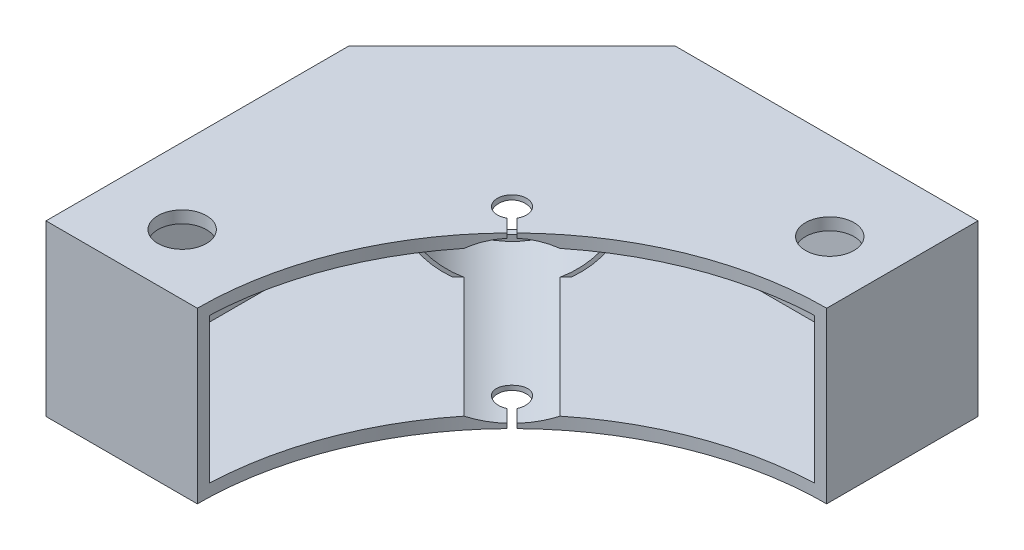
from build123d import *

# Parameters (mm, degrees)
BOSS_EXTRUDE1_DEPTH      = 28
SHELL1_T                 = -2
CUT_EXTRUDE1_DEPTH       = 12
CUT_EXTRUDE1_DEPTH_BACK  = 12
SKETCH9_R                = 6.4
SKETCH12_R               = 4
CUT_EXTRUDE3_DEPTH       = 2
BOSS_EXTRUDE2_DEPTH      = 0.0001
BOSS_EXTRUDE2_DEPTH_BACK = 10
SKETCH11_R               = 13.85
CUT_EXTRUDE4_DEPTH       = 35
CUT_EXTRUDE4_DEPTH_BACK  = 9
SKETCH13_R               = 13.25
CUT_EXTRUDE5_DEPTH       = 10
CUT_EXTRUDE5_DEPTH_BACK  = 10
SKETCH15_R               = 12.25


with BuildPart() as part:
    # Sketch1 → Boss-Extrude1 (new body)
    with BuildSketch(Plane(origin=(0, 0, 0), x_dir=(1, 0, 0), z_dir=(0, 1, 0))):
        with BuildLine():
            Line((0, 0), (0, 50))
            Line((0, 50), (27, 77))
            Line((27, 77), (77, 77))
            Line((77, 77), (77, 52))
            ThreePointArc((77, 52), (57.377961172, 48.155743087), (40.657159206, 37.191368932))
            Line((40.657159206, 37.191368932), (38.535838862, 39.312689275))
            ThreePointArc((38.535838862, 39.312689275), (34.771350846, 42.228649154), (37.687310725, 38.464161138))
            Line((37.687310725, 38.464161138), (39.808631068, 36.342840794))
            ThreePointArc((39.808631068, 36.342840794), (28.844256913, 19.622038828), (25, 0))
            Line((25, 0), (0, 0))
        make_face()
    extrude(amount=BOSS_EXTRUDE1_DEPTH)

    # Shell1
    shell1_openings = [part.faces().sort_by_distance(p)[0] for p in [
        (57.377961172, 14, -48.155743087),
        (28.844256913, 14, -19.622038828),
    ]]
    offset(amount=SHELL1_T, openings=shell1_openings, kind=Kind.INTERSECTION)

    # Sketch9 → Cut-Extrude1 (cut, two sides: drawn at the far end of the back side and taken through both)
    with BuildSketch(Plane(origin=(0, 14, 0), x_dir=(1, 0, 0), z_dir=(0, 1, 0)).offset(-CUT_EXTRUDE1_DEPTH_BACK)):
        with Locations((36.184678266, 38.815321734)):
            Circle(SKETCH9_R)
    extrude(amount=CUT_EXTRUDE1_DEPTH + CUT_EXTRUDE1_DEPTH_BACK, mode=Mode.SUBTRACT)

    # Sketch12 → Cut-Extrude3 (cut)
    with BuildSketch(Plane(origin=(0, 28, 0), x_dir=(1, 0, 0), z_dir=(0, 1, 0))):
        with Locations((67, 62.5)):
            Circle(SKETCH12_R)
        with Locations((12.5, 10)):
            Circle(SKETCH12_R)
    extrude(amount=-CUT_EXTRUDE3_DEPTH, mode=Mode.SUBTRACT)

    # Sketch11 → Boss-Extrude2 (add, two sides: drawn at the far end of the back side and taken through both)
    with BuildSketch(Plane(origin=(-25, 0, -25), x_dir=(-0.7071067811865435, 0, 0.7071067811865517), z_dir=(-0.7071067811865517, 0, -0.7071067811865435)).offset(-BOSS_EXTRUDE2_DEPTH_BACK)):
        with Locations((-54.447222151, 14)):
            Circle(SKETCH11_R)
    extrude(amount=BOSS_EXTRUDE2_DEPTH + BOSS_EXTRUDE2_DEPTH_BACK)

    # Sketch13 → Cut-Extrude4 (cut, two sides: drawn at the far end of the back side and taken through both)
    with BuildSketch(Plane(origin=(-17.928932188, 0, -17.928932188), x_dir=(0.7071067811865435, 0, -0.7071067811865516), z_dir=(0.7071067811865516, 0, 0.7071067811865435)).offset(-CUT_EXTRUDE4_DEPTH_BACK)):
        with Locations((54.447222151, 14)):
            Circle(SKETCH13_R)
    extrude(amount=CUT_EXTRUDE4_DEPTH + CUT_EXTRUDE4_DEPTH_BACK, mode=Mode.SUBTRACT)

    # Sketch15 → Cut-Extrude5 (cut, two sides: drawn at the far end of the back side and taken through both)
    with BuildSketch(Plane(origin=(-25, 0, -25), x_dir=(-0.7071067811865435, 0, 0.7071067811865517), z_dir=(-0.7071067811865517, 0, -0.7071067811865435)).offset(-CUT_EXTRUDE5_DEPTH_BACK)):
        with Locations((-54.447222151, 14)):
            Circle(SKETCH15_R)
    extrude(amount=CUT_EXTRUDE5_DEPTH + CUT_EXTRUDE5_DEPTH_BACK, mode=Mode.SUBTRACT)


solid = part.part
